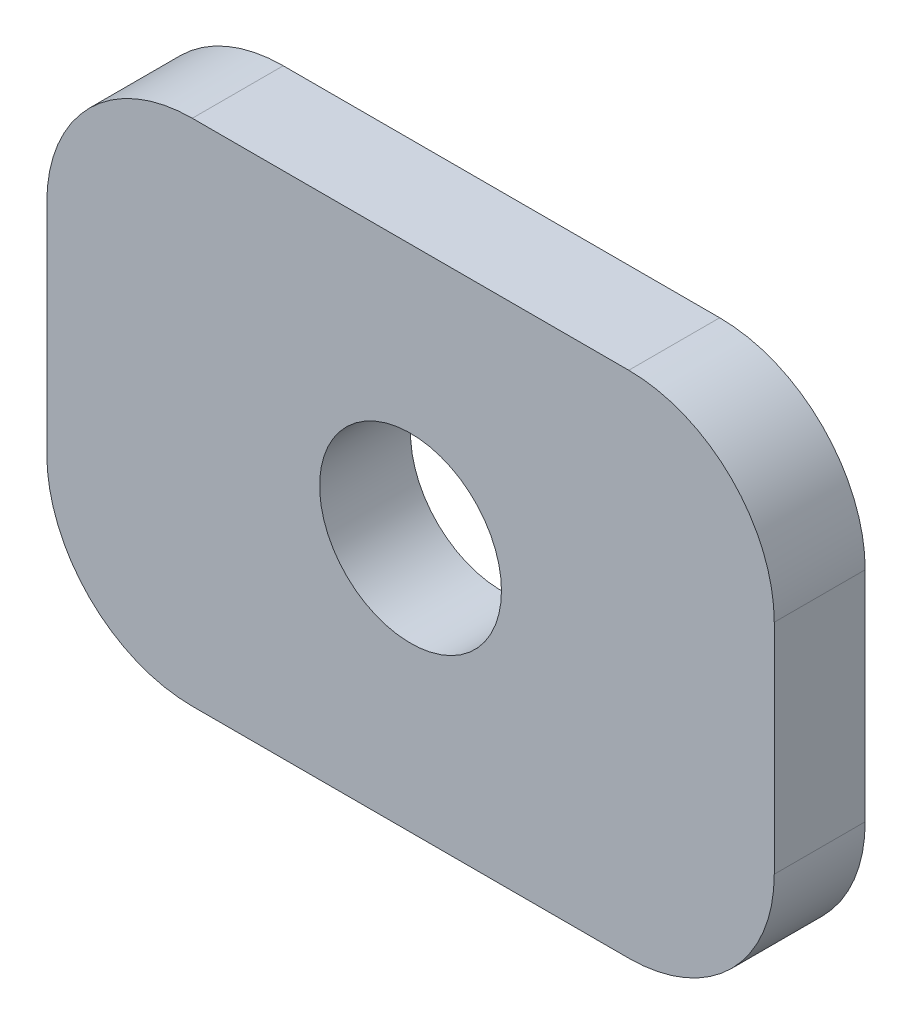
from build123d import *

# Parameters (mm, degrees)
SKETCH1_W           = 25.4
SKETCH1_H           = 17.78
BOSS_EXTRUDE1_DEPTH = 3.175
HOLE1_D             = 6.35
FILLET1_R           = 5.08


with BuildPart() as part:
    # Sketch1 → Boss-Extrude1 (new body)
    with BuildSketch(Plane.XY):
        with Locations((12.7, -8.89)):
            Rectangle(SKETCH1_W, SKETCH1_H)
    extrude(amount=BOSS_EXTRUDE1_DEPTH)

    # Hole1 (through all)
    with Locations(Plane.XY.offset(3.175)):
        with Locations((12.7, -8.89)):
            Hole(HOLE1_D / 2)

    # Fillet1
    fillet1_edges = [part.edges().sort_by_distance(p)[0] for p in [
        (0, 0, 1.5875),
        (25.4, 0, 1.5875),
        (25.4, -17.78, 1.5875),
        (0, -17.78, 1.5875),
    ]]
    fillet(fillet1_edges, radius=FILLET1_R)


solid = part.part
